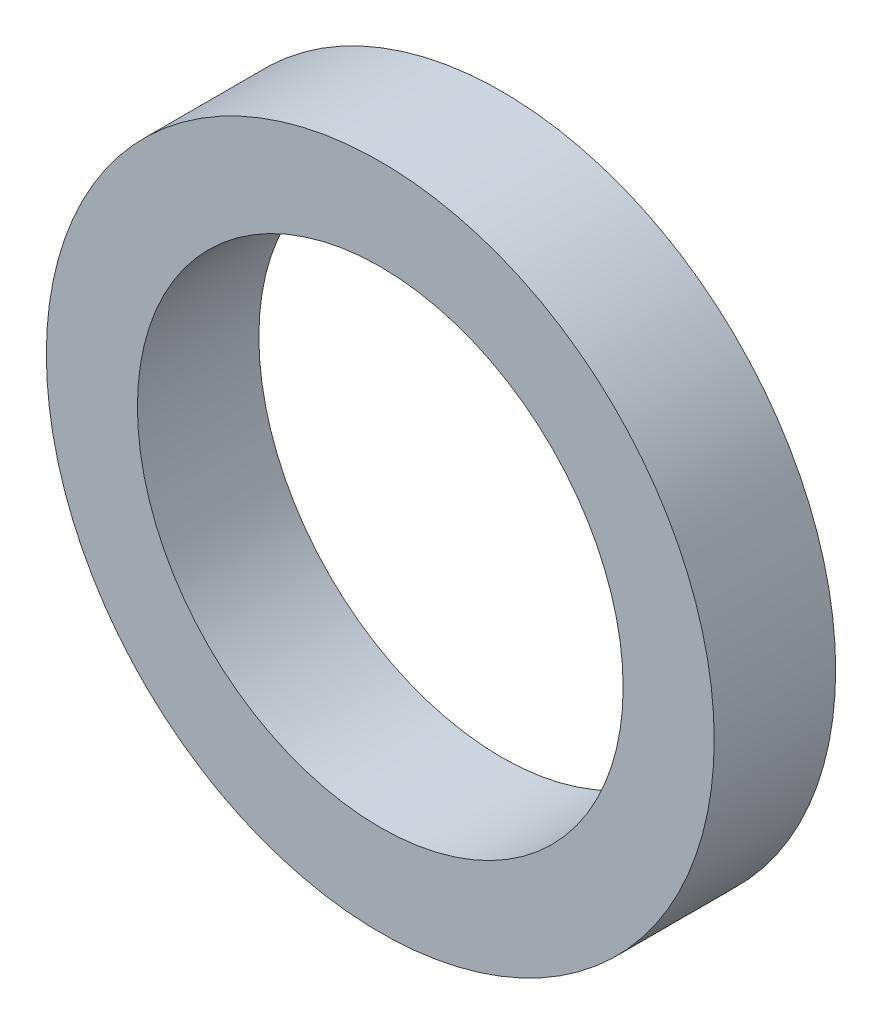
from build123d import *

# Parameters (mm, degrees)
SKETCH_1_R      = 11
SKETCH_1_R_2    = 8
EXTRUDE_1_DEPTH = 4


with BuildPart() as part:
    # 草图1 → 凸台-拉伸1 (new body)
    with BuildSketch(Plane.XY):
        Circle(SKETCH_1_R)
        Circle(SKETCH_1_R_2, mode=Mode.SUBTRACT)
    extrude(amount=EXTRUDE_1_DEPTH)


solid = part.part
